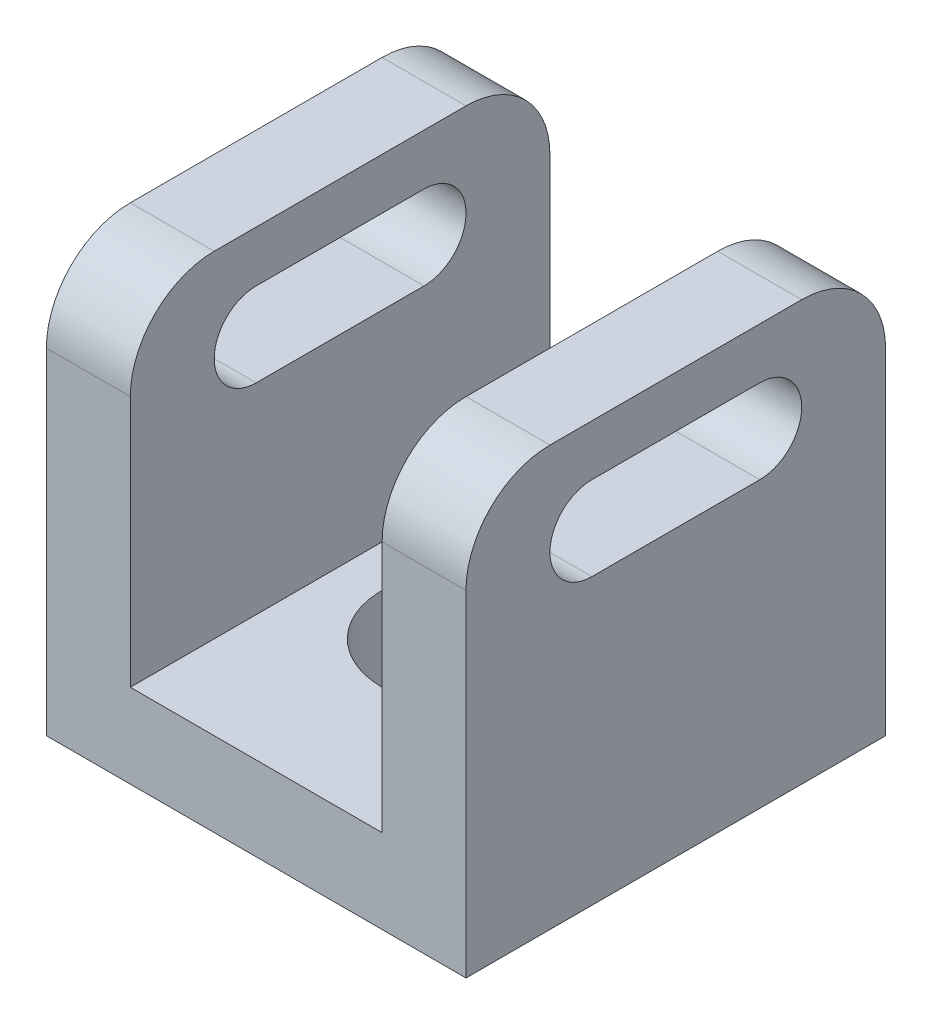
from build123d import *

# Parameters (mm, degrees)
Y_KSEKLIK_EKSTR_ZYON1_DEPTH = 50
KES_EKSTR_ZYON1_REACH       = 94.844
IZIM2_R                     = 10
KES_EKSTR_ZYON2_DEPTH       = 77.329104323
KES_EKSTR_ZYON2_DEPTH_BACK  = 77.329104323
RADYUS1_R                   = 10
RADYUS2_R                   = 10


with BuildPart() as part:
    # Çizim1 → Yükseklik-Ekstrüzyon1 (new body)
    with BuildSketch(Plane.XY):
        Polygon((-57.23116586, -11.25748503), (-27.23116586, -11.25748503), (-27.23116586, 28.74251497), (-17.23116586, 28.74251497), (-17.23116586, 21.706586826), (-17.23116586, -21.25748503), (-67.23116586, -21.25748503), (-67.23116586, 21.706586826), (-67.23116586, 28.74251497), (-57.23116586, 28.74251497), align=None)
    extrude(amount=Y_KSEKLIK_EKSTR_ZYON1_DEPTH)

    # Çizim2 → Kes-Ekstrüzyon1 (cut, up to next)
    with BuildSketch(Plane(origin=(0, -11.25748503, 0), x_dir=(1, 0, 0), z_dir=(0, 1, 0)), mode=Mode.PRIVATE) as kes_ekstr_zyon1_sk1:
        with Locations(Location((-42.23116586, -25, 0), (0, 0, 270))):
            Circle(IZIM2_R)
    kes_ekstr_zyon1_tool1 = extrude(kes_ekstr_zyon1_sk1.sketch, amount=-KES_EKSTR_ZYON1_REACH, mode=Mode.PRIVATE) & part.part
    add(kes_ekstr_zyon1_tool1.solids().sort_by_distance((-42.231166, -11.257485, 25))[0], mode=Mode.SUBTRACT)

    # Çizim3 → Kes-Ekstrüzyon2 (cut, two sides: drawn at the far end of the back side and taken through both)
    with BuildSketch(Plane(origin=(-17.23116586, 0, 0), x_dir=(0, 0, -1), z_dir=(1, 0, 0)).offset(-KES_EKSTR_ZYON2_DEPTH_BACK)):
        with BuildLine():
            Line((-35, 22.662565506), (-15, 22.662565506))
            ThreePointArc((-15, 22.662565506), (-10, 17.662565506), (-15, 12.662565506))
            Line((-15, 12.662565506), (-35, 12.662565506))
            ThreePointArc((-35, 12.662565506), (-40, 17.662565506), (-35, 22.662565506))
        make_face()
    extrude(amount=KES_EKSTR_ZYON2_DEPTH + KES_EKSTR_ZYON2_DEPTH_BACK, mode=Mode.SUBTRACT)

    # Radyus1
    radyus1_edges = [part.edges().sort_by_distance(p)[0] for p in [
        (-62.23116586, 28.74251497, 0),
        (-62.23116586, 28.74251497, 50),
    ]]
    fillet(radyus1_edges, radius=RADYUS1_R)

    # Radyus2
    radyus2_edges = [part.edges().sort_by_distance(p)[0] for p in [
        (-22.23116586, 28.74251497, 0),
        (-22.23116586, 28.74251497, 50),
    ]]
    fillet(radyus2_edges, radius=RADYUS2_R)


solid = part.part
